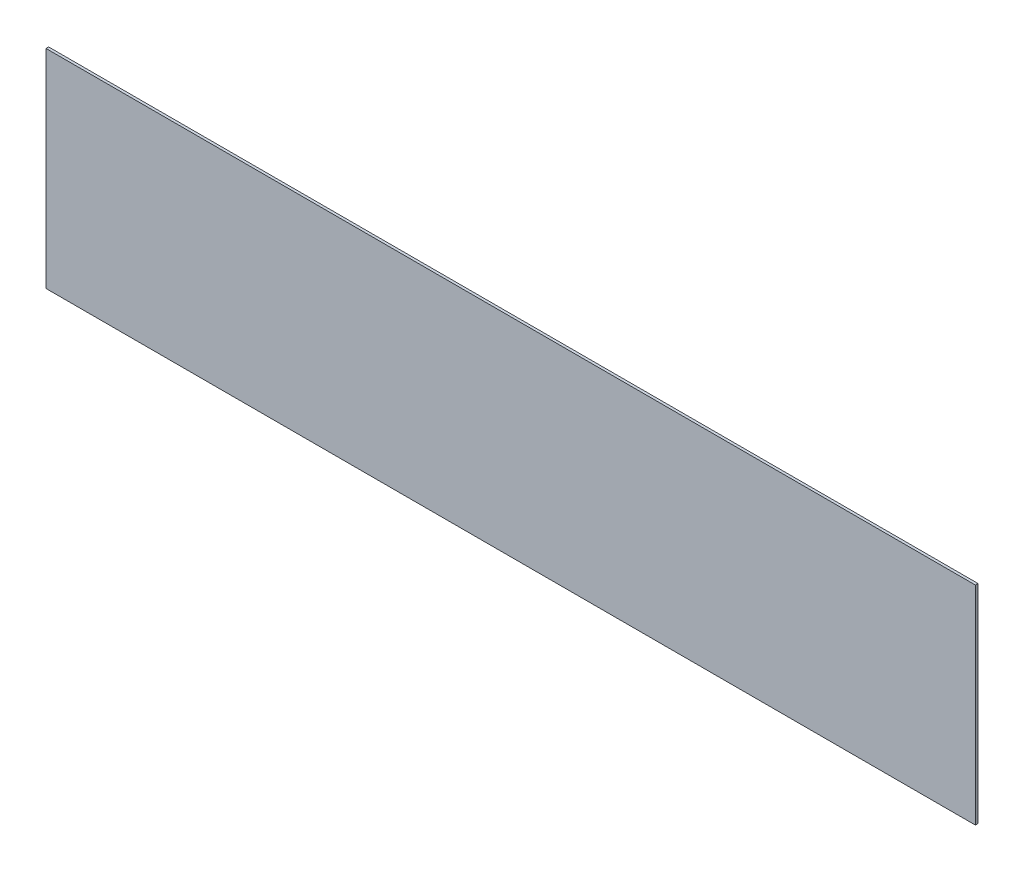
from build123d import *

# Parameters (mm, degrees)
SKETCH1_W           = 447
SKETCH1_H           = 100
BOSS_EXTRUDE1_DEPTH = 1.27


with BuildPart() as part:
    # Sketch1 → Boss-Extrude1 (new body)
    with BuildSketch(Plane.XY):
        with Locations((223.5, 50)):
            Rectangle(SKETCH1_W, SKETCH1_H)
    extrude(amount=BOSS_EXTRUDE1_DEPTH)


solid = part.part
